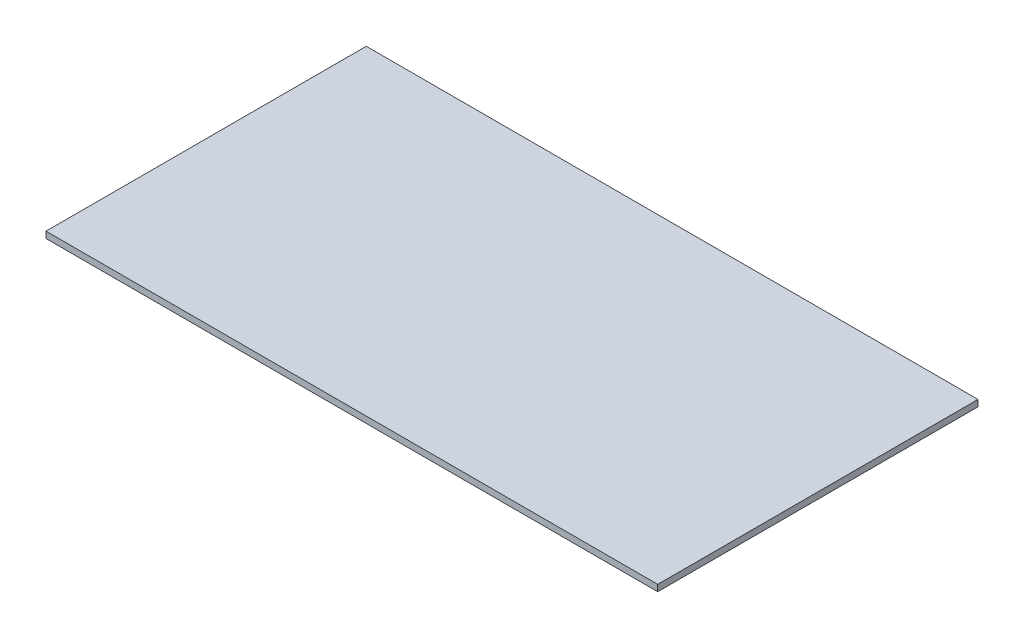
from build123d import *

# Parameters (mm, degrees)
SKETCH_1_W      = 191
SKETCH_1_H      = 100
EXTRUDE_1_DEPTH = 2


with BuildPart() as part:
    # 草图1 → 凸台-拉伸1 (new body)
    with BuildSketch(Plane(origin=(0, 0, 0), x_dir=(1, 0, 0), z_dir=(0, 1, 0))):
        with Locations((42.178480077, -24.308722219)):
            Rectangle(SKETCH_1_W, SKETCH_1_H)
    extrude(amount=EXTRUDE_1_DEPTH)


solid = part.part
